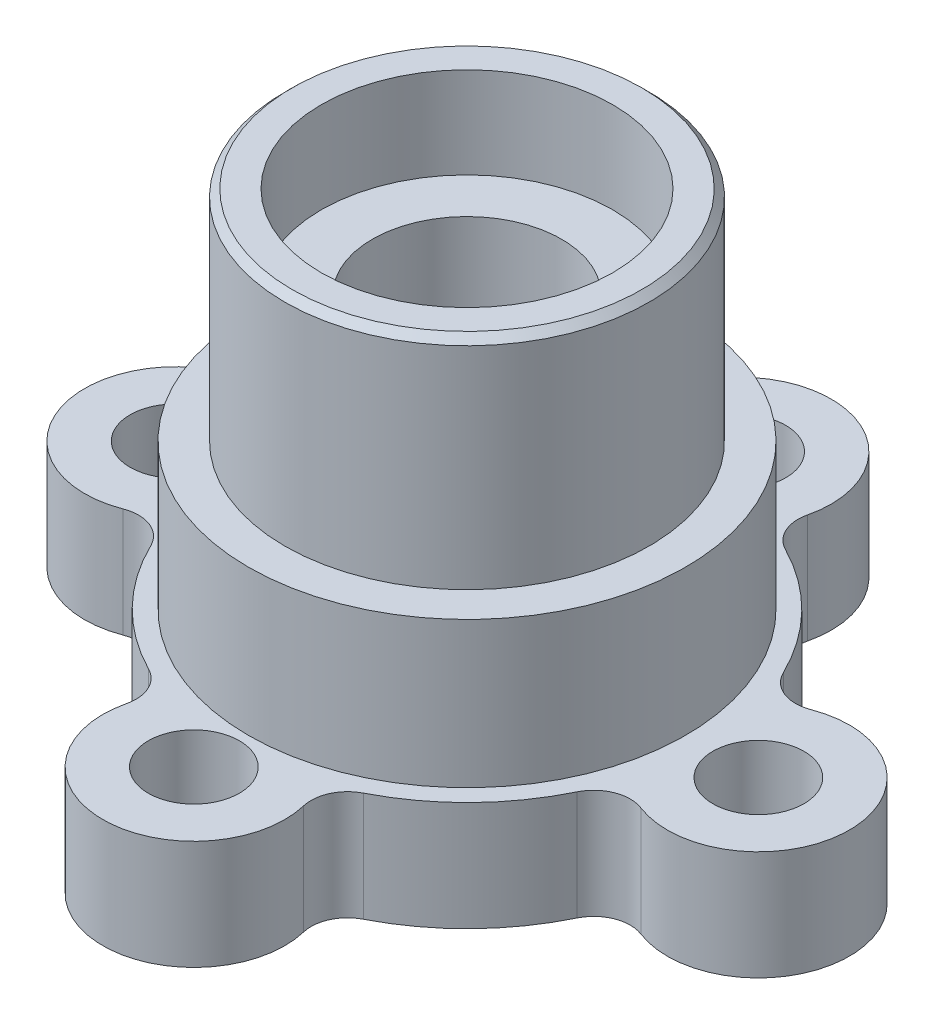
from build123d import *

# Parameters (mm, degrees)
BOSS_EXTRUDE1_DEPTH   = 3
SKETCH2_R             = 6
BOSS_EXTRUDE2_DEPTH   = 4
SKETCH3_R             = 5
BOSS_EXTRUDE3_DEPTH   = 6
SKETCH4_R             = 2.6
CUT_EXTRUDE1_DEPTH    = 20.474342094
SKETCH5_R             = 4
CUT_EXTRUDE2_DEPTH    = 2.5
CUT_EXTRUDE3_START    = -3
SKETCH6_R             = 4
CUT_EXTRUDE3_DEPTH    = 3
M3X0_5_TAPPED_HOLE1_D = 2.5
CHAMFER1_SIZE         = 0.2
FILLET1_R             = 1


with BuildPart() as part:
    # Sketch1 → Boss-Extrude1 (new body)
    with BuildSketch(Plane(origin=(0, 0, 0), x_dir=(1, 0, 0), z_dir=(0, 1, 0))):
        with BuildLine():
            ThreePointArc((-2.104162541, 6.15), (-4.71280541, 4.47654612), (-6.25, 1.785357107))
            ThreePointArc((-6.25, 1.785357107), (-10.5, 0), (-6.25, -1.785357107))
            ThreePointArc((-6.25, -1.785357107), (-4.71280541, -4.47654612), (-2.104162541, -6.15))
            ThreePointArc((-2.104162541, -6.15), (0, -10), (2.104162541, -6.15))
            ThreePointArc((2.104162541, -6.15), (4.71280541, -4.47654612), (6.25, -1.785357107))
            ThreePointArc((6.25, -1.785357107), (10.5, 0), (6.25, 1.785357107))
            ThreePointArc((6.25, 1.785357107), (4.71280541, 4.47654612), (2.104162541, 6.15))
            ThreePointArc((2.104162541, 6.15), (0, 10), (-2.104162541, 6.15))
        make_face()
    extrude(amount=BOSS_EXTRUDE1_DEPTH)

    # Sketch2 → Boss-Extrude2 (add)
    with BuildSketch(Plane(origin=(0, 3, 0), x_dir=(1, 0, 0), z_dir=(0, 1, 0))):
        with Locations(Location((0, 0, 0), (0, 0, 270))):
            Circle(SKETCH2_R)
    extrude(amount=BOSS_EXTRUDE2_DEPTH)

    # Sketch3 → Boss-Extrude3 (add)
    with BuildSketch(Plane(origin=(0, 7, 0), x_dir=(1, 0, 0), z_dir=(0, 1, 0))):
        with Locations(Location((0, 0, 0), (0, 0, 270))):
            Circle(SKETCH3_R)
    extrude(amount=BOSS_EXTRUDE3_DEPTH)

    # Sketch4 → Cut-Extrude1 (cut, through all)
    with BuildSketch(Plane(origin=(0, 13, 0), x_dir=(1, 0, 0), z_dir=(0, 1, 0))):
        with Locations(Location((0, 0, 0), (0, 0, 270))):
            Circle(SKETCH4_R)
    extrude(amount=-CUT_EXTRUDE1_DEPTH, mode=Mode.SUBTRACT)

    # Sketch5 → Cut-Extrude2 (cut)
    with BuildSketch(Plane(origin=(0, 13, 0), x_dir=(1, 0, 0), z_dir=(0, 1, 0))):
        with Locations(Location((0, 0, 0), (0, 0, 270))):
            Circle(SKETCH5_R)
    extrude(amount=-CUT_EXTRUDE2_DEPTH, mode=Mode.SUBTRACT)

    # Sketch6 → Cut-Extrude3 (cut)
    with BuildSketch(Plane.XZ.offset(CUT_EXTRUDE3_START)):
        with Locations(Location((0, 0, 0), (0, 0, 90))):
            Circle(SKETCH6_R)
    extrude(amount=CUT_EXTRUDE3_DEPTH, mode=Mode.SUBTRACT)

    # M3x0.5 Tapped Hole1 (through all)
    with Locations(Plane(origin=(0, 3, 0), x_dir=(1, 0, 0), z_dir=(0, 1, 0))):
        with Locations((0, 7.5), (8, 0), (0, -7.5), (-8, 0)):
            Hole(M3X0_5_TAPPED_HOLE1_D / 2)

    # Chamfer1
    chamfer1_edges = [part.edges().sort_by_distance(p)[0] for p in [
        (0, 13, -5),
    ]]
    chamfer(chamfer1_edges, length=CHAMFER1_SIZE)

    # Fillet1
    fillet1_edges = [part.edges().sort_by_distance(p)[0] for p in [
        (6.25, 1.5, -1.785357107),
        (6.25, 1.5, 1.785357107),
        (2.104162541, 1.5, 6.15),
        (-2.104162541, 1.5, 6.15),
        (-6.25, 1.5, 1.785357107),
        (-6.25, 1.5, -1.785357107),
        (-2.104162541, 1.5, -6.15),
        (2.104162541, 1.5, -6.15),
    ]]
    fillet(fillet1_edges, radius=FILLET1_R)


solid = part.part
